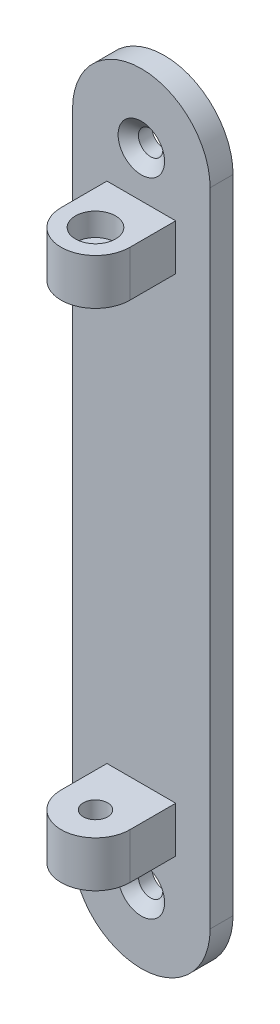
from build123d import *

# Parameters (mm, degrees)
BOSS_EXTRUDE1_DEPTH                                 = 6.35
CSK_FOR_1_4_FLAT_HEAD_MACHINE_SCREW_100_D           = 6.7564
CSK_FOR_1_4_FLAT_HEAD_MACHINE_SCREW_100_CSINK_D     = 12.8778
CSK_FOR_1_4_FLAT_HEAD_MACHINE_SCREW_100_CSINK_ANGLE = 100
SKETCH5_W                                           = 19.05
SKETCH5_H                                           = 12.7
BOSS_EXTRUDE2_DEPTH                                 = 12.7
BOSS_EXTRUDE3_DEPTH                                 = 12.7
CBORE_FOR_1_4_SOCKET_HEAD_CAP_SCREW1_D              = 6.7564
CBORE_FOR_1_4_SOCKET_HEAD_CAP_SCREW1_DEPTH          = 12.7
CBORE_FOR_1_4_SOCKET_HEAD_CAP_SCREW1_CBORE_D        = 11.1125
CBORE_FOR_1_4_SOCKET_HEAD_CAP_SCREW1_CBORE_DEPTH    = 6.35
CBORE_FOR_1_4_SOCKET_HEAD_CAP_SCREW1_TIP            = 2.029827343


with BuildPart() as part:
    # Sketch1 → Boss-Extrude1 (new body)
    with BuildSketch(Plane.XY):
        with BuildLine():
            Line((0, 0), (38.1, 0))
            Line((38.1, 0), (38.1, 88.9))
            ThreePointArc((38.1, 88.9), (19.05, 107.95), (0, 88.9))
            Line((0, 88.9), (0, 0))
        make_face()
    extrude(amount=BOSS_EXTRUDE1_DEPTH)

    # CSK for 1/4 Flat Head Machine Screw (100)1 (through all)
    with Locations(Plane.XY.offset(6.35)):
        with Locations((19.05, 88.9)):
            CounterSinkHole(CSK_FOR_1_4_FLAT_HEAD_MACHINE_SCREW_100_D / 2, CSK_FOR_1_4_FLAT_HEAD_MACHINE_SCREW_100_CSINK_D / 2, counter_sink_angle=CSK_FOR_1_4_FLAT_HEAD_MACHINE_SCREW_100_CSINK_ANGLE)

    # Sketch5 → Boss-Extrude2 (add)
    with BuildSketch(Plane.XY.offset(6.35)):
        with Locations((19.05, 69.85)):
            Rectangle(SKETCH5_W, SKETCH5_H)
    extrude(amount=BOSS_EXTRUDE2_DEPTH)

    # Sketch6 → Boss-Extrude3 (add)
    with BuildSketch(Plane(origin=(0, 76.2, 0), x_dir=(1, 0, 0), z_dir=(0, 1, 0))):
        with BuildLine():
            Line((9.525, -19.05), (28.575, -19.05))
            ThreePointArc((28.575, -19.05), (19.05, -28.575), (9.525, -19.05))
        make_face()
    extrude(amount=-BOSS_EXTRUDE3_DEPTH)

    # CBORE for 1/4 Socket Head Cap Screw1
    with Locations(Plane(origin=(0, 76.2, 0), x_dir=(1, 0, 0), z_dir=(0, 1, 0))):
        with Locations((19.05, -19.05)):
            CounterBoreHole(CBORE_FOR_1_4_SOCKET_HEAD_CAP_SCREW1_D / 2, CBORE_FOR_1_4_SOCKET_HEAD_CAP_SCREW1_CBORE_D / 2, CBORE_FOR_1_4_SOCKET_HEAD_CAP_SCREW1_CBORE_DEPTH, depth=CBORE_FOR_1_4_SOCKET_HEAD_CAP_SCREW1_DEPTH)
            with Locations((0, 0, -(CBORE_FOR_1_4_SOCKET_HEAD_CAP_SCREW1_DEPTH + CBORE_FOR_1_4_SOCKET_HEAD_CAP_SCREW1_TIP / 2))):  # 118° drill point
                Cone(0, CBORE_FOR_1_4_SOCKET_HEAD_CAP_SCREW1_D / 2, CBORE_FOR_1_4_SOCKET_HEAD_CAP_SCREW1_TIP, mode=Mode.SUBTRACT)

    # Mirror1: part across plane


with BuildPart() as part_1:
    add(part.part)
    add(part.part.mirror(Plane(origin=(0, 0, 6.35), x_dir=(0, 0, 1), z_dir=(0, 1, 0))))


solid = part_1.part
